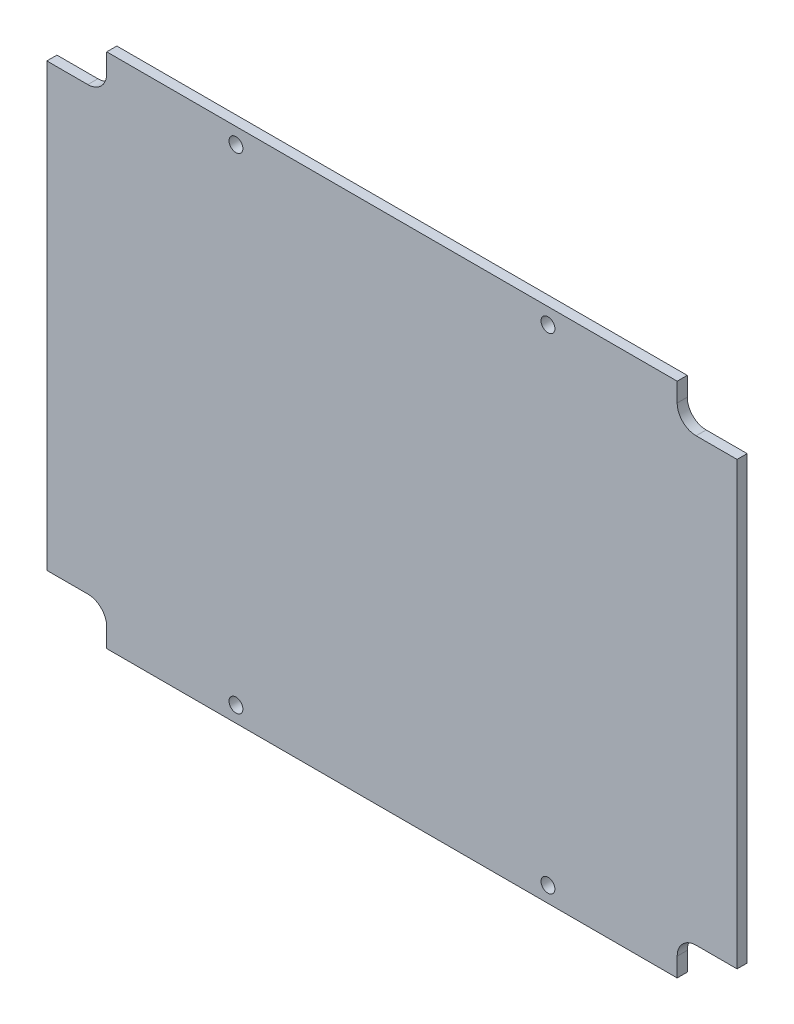
from build123d import *

# Parameters (mm, degrees)
SKETCH1_R           = 1.1
BOSS_EXTRUDE1_DEPTH = 1.6
FILLET1_R           = 3


with BuildPart() as part:
    # Sketch1 → Boss-Extrude1 (new body)
    with BuildSketch(Plane.XY):
        Polygon((-55.493641502, 79.95185693), (-45.993641502, 79.95185693), (-45.993641502, 85.95185693), (44.506358498, 85.95185693), (44.506358498, 79.95185693), (54.006358498, 79.95185693), (54.006358498, 9.95185693), (44.506358498, 9.95185693), (44.506358498, 3.95185693), (-45.993641502, 3.95185693), (-45.993641502, 9.95185693), (-55.493641502, 9.95185693), align=None)
        with Locations((-25.493641502, 83.45185693)):
            Circle(SKETCH1_R, mode=Mode.SUBTRACT)
        with Locations((24.006358498, 83.45185693)):
            Circle(SKETCH1_R, mode=Mode.SUBTRACT)
        with Locations((24.006358498, 6.45185693)):
            Circle(SKETCH1_R, mode=Mode.SUBTRACT)
        with Locations((-25.493641502, 6.45185693)):
            Circle(SKETCH1_R, mode=Mode.SUBTRACT)
    extrude(amount=BOSS_EXTRUDE1_DEPTH)

    # Fillet1
    fillet1_edges = [part.edges().sort_by_distance(p)[0] for p in [
        (-45.993641502, 79.95185693, 0.8),
        (44.506358498, 79.95185693, 0.8),
        (44.506358498, 9.95185693, 0.8),
        (-45.993641502, 9.95185693, 0.8),
    ]]
    fillet(fillet1_edges, radius=FILLET1_R)


solid = part.part
